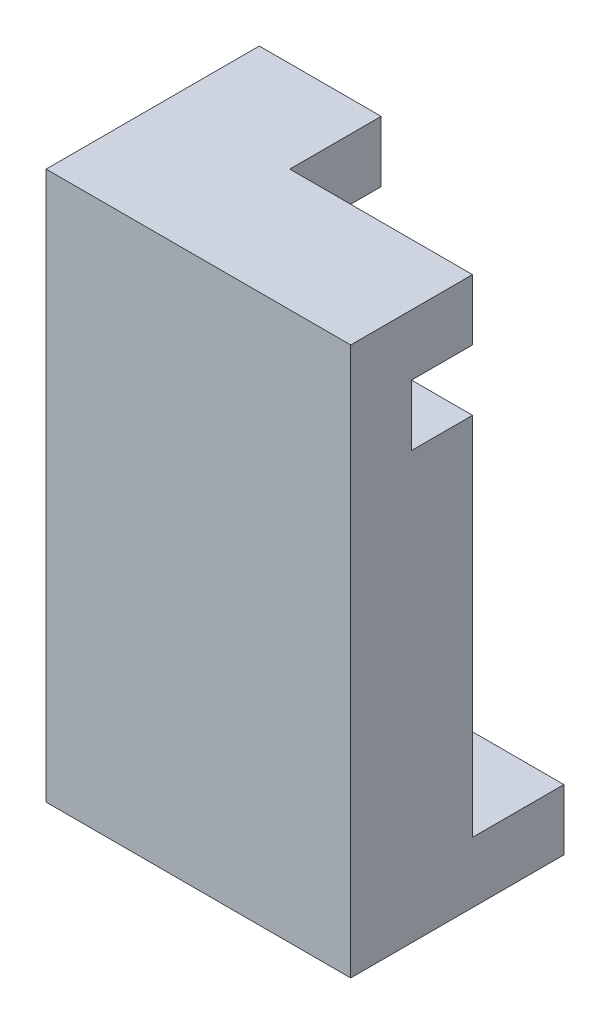
from build123d import *

# Parameters (mm, degrees)
EXTRUDE_1_DEPTH          = 40
SKETCH_2_W               = 25
SKETCH_2_H               = 25
EXTRUDE_2_DEPTH          = 5
SKETCH_3_W               = 20
SKETCH_3_H               = 5
CUT_EXTRUDE_1_DEPTH      = 20
CUT_EXTRUDE_2_DEPTH      = 50.497474683
CUT_EXTRUDE_2_DEPTH_BACK = 50.497474683
SKETCH_4_W               = 7.5
SKETCH_4_H               = 45


with BuildPart() as part:
    # 스케치1 → 보스-돌출1 (new body)
    with BuildSketch(Plane(origin=(0, 0, 0), x_dir=(1, 0, 0), z_dir=(0, 1, 0))):
        Polygon((0, 0), (25, 0), (25, 10), (10, 10), (10, 25), (0, 25), align=None)
    extrude(amount=EXTRUDE_1_DEPTH)

    # 스케치2 → 보스-돌출2 (add)
    with BuildSketch(Plane.XZ):
        with Locations((12.5, -12.5)):
            Rectangle(SKETCH_2_W, SKETCH_2_H)
    extrude(amount=EXTRUDE_2_DEPTH)

    # 스케치3 → 컷-돌출1 (cut)
    with BuildSketch(Plane(origin=(0, 0, -25), x_dir=(-1, 0, 0), z_dir=(0, 0, -1))):
        with Locations((-15, 32.5)):
            Rectangle(SKETCH_3_W, SKETCH_3_H)
    extrude(amount=-CUT_EXTRUDE_1_DEPTH, mode=Mode.SUBTRACT)

    # 스케치4 → 컷-돌출2 (cut, two sides: drawn at the far end of the back side and taken through both)
    with BuildSketch(Plane(origin=(10, 0, 0), x_dir=(0, 0, -1), z_dir=(1, 0, 0)).offset(-CUT_EXTRUDE_2_DEPTH_BACK)):
        with Locations((21.25, 17.5)):
            Rectangle(SKETCH_4_W, SKETCH_4_H)
    extrude(amount=CUT_EXTRUDE_2_DEPTH + CUT_EXTRUDE_2_DEPTH_BACK, mode=Mode.SUBTRACT)


solid = part.part
